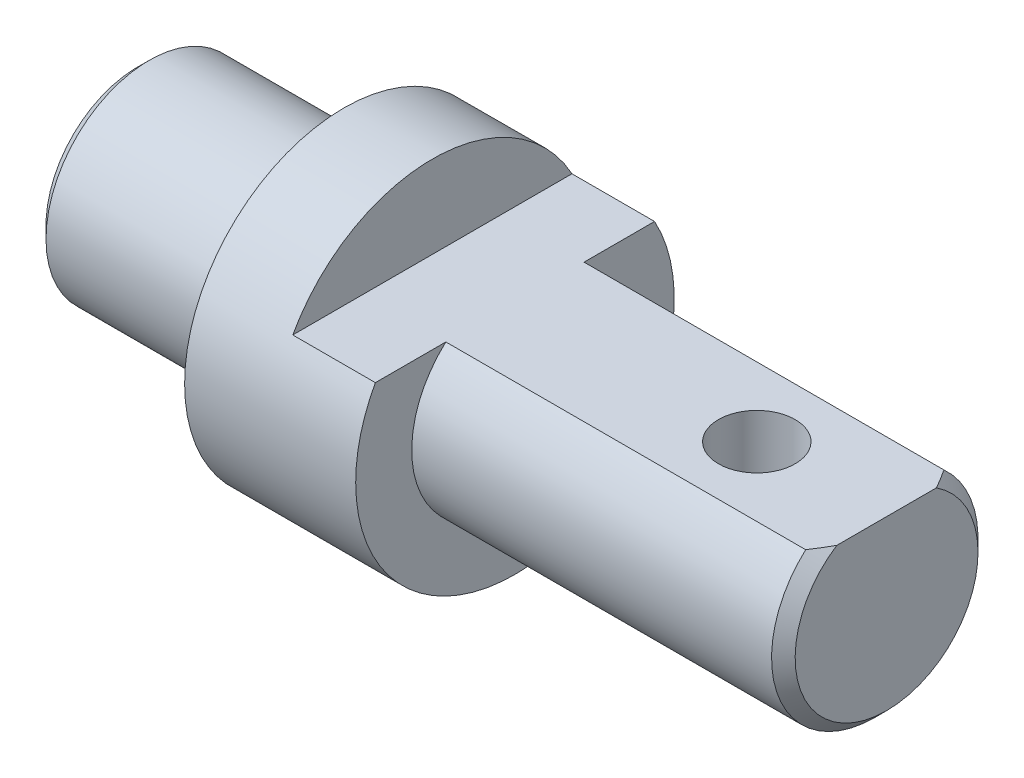
from build123d import *

# Parameters (mm, degrees)
SKETCH4_W                      = 3
SKETCH4_H                      = 1
SKETCH5_W                      = 47.328638264
SKETCH5_H                      = 14
CUT_EXTRUDE1_DEPTH             = 77
F_1_2_0_51181102_DOWEL_HOLE1_D = 12.999999908
CHAMFER1_SIZE                  = 2


with BuildPart() as part:
    # Sketch2 → Revolve1 (revolve)
    with BuildSketch(Plane.XY, mode=Mode.PRIVATE) as revolve1_sk:
        Polygon((-63.5, 0), (-63.5, 17.5), (-28.5, 17.5), (-28.5, 27), (0.5, 27), (0.5, 17.5), (63.5, 17.5), (63.5, 0), align=None)
    revolve(revolve1_sk.sketch.rotate(Axis((-63.5, 0, 0), (1, 0, 0)), 90), axis=Axis((-63.5, 0, 0), (1, 0, 0)))

    # Sketch4 → Cut-Revolve1 (revolve, cut)
    with BuildSketch(Plane.XY, mode=Mode.PRIVATE) as cut_revolve1_sk:
        with Locations((-30, 17)):
            Rectangle(SKETCH4_W, SKETCH4_H)
    revolve(cut_revolve1_sk.sketch.rotate(Axis((-63.5, 0, 0), (1, 0, 0)), 90), axis=Axis((-63.5, 0, 0), (1, 0, 0)), mode=Mode.SUBTRACT)

    # Sketch5 → Cut-Extrude1 (cut)
    with BuildSketch(Plane(origin=(63.5, 0, 0), x_dir=(0, 0, -1), z_dir=(1, 0, 0))):
        with Locations((0, 20)):
            Rectangle(SKETCH5_W, SKETCH5_H)
    extrude(amount=-CUT_EXTRUDE1_DEPTH, mode=Mode.SUBTRACT)

    # 1/2 (0.51181102) Dowel Hole1 (through all)
    with Locations(Plane(origin=(0, 13, 0), x_dir=(1, 0, 0), z_dir=(0, 1, 0))):
        with Locations((41.5, 0)):
            Hole(F_1_2_0_51181102_DOWEL_HOLE1_D / 2)

    # Chamfer1
    chamfer1_edges = [part.edges().sort_by_distance(p)[0] for p in [
        (63.5, -17.5, 0),
        (-63.5, 0, -17.5),
    ]]
    chamfer(chamfer1_edges, length=CHAMFER1_SIZE)


solid = part.part
